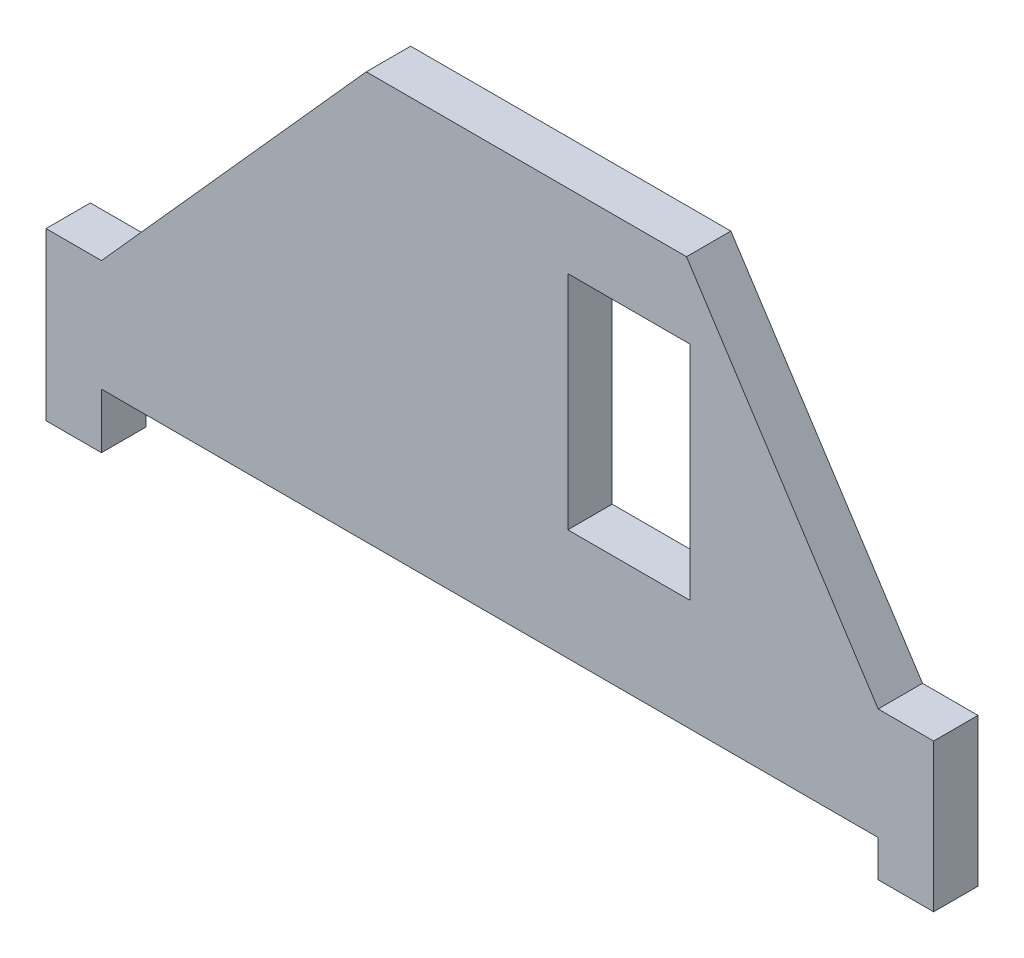
from build123d import *

# Parameters (mm, degrees)
SKETCH2_W           = 279.4
SKETCH2_H           = 508
BOSS_EXTRUDE2_DEPTH = 101.6


with BuildPart() as part:
    # Sketch2 → Boss-Extrude2 (new body)
    with BuildSketch(Plane.XY):
        Polygon((-127, 338.666666667), (0, 338.666666667), (0, 0), (-127, 0), (-127, 83.800178309), (-1905, 83.800178309), (-1905, -42.333333333), (-2032, -42.333333333), (-2032, 338.666666667), (-1905, 338.666666667), (-1298.870787435, 1016), (-565.751483096, 1016), align=None)
        with Locations((-697.738, 592.666666667)):
            Rectangle(SKETCH2_W, SKETCH2_H, mode=Mode.SUBTRACT)
    extrude(amount=BOSS_EXTRUDE2_DEPTH)


solid = part.part
